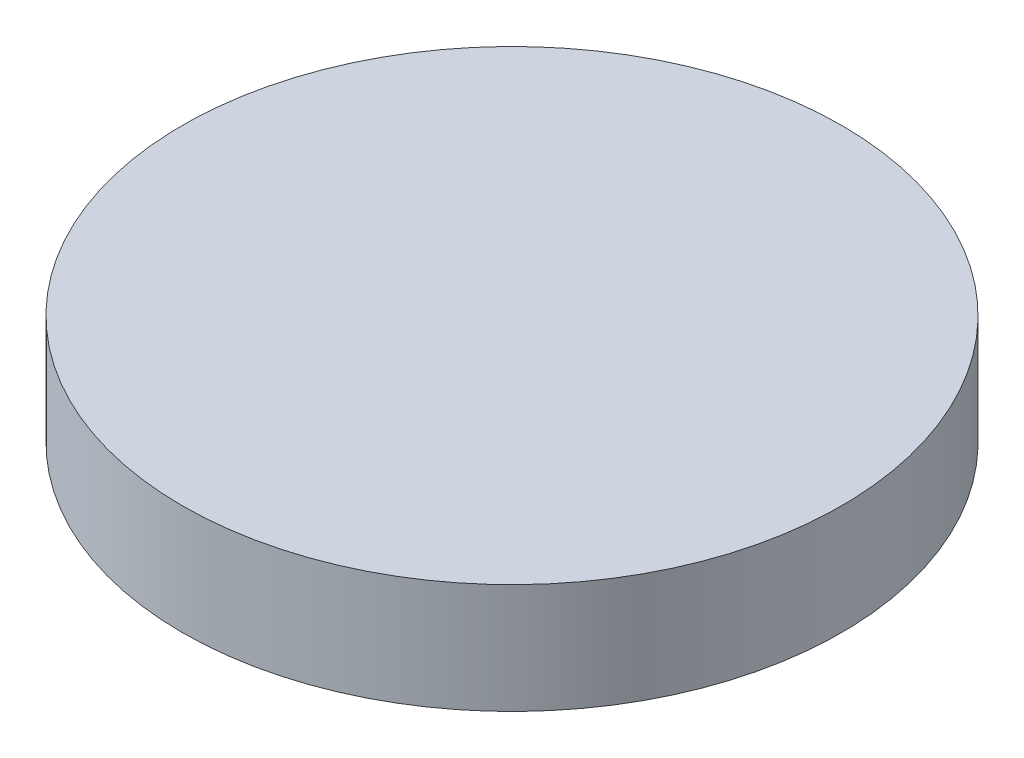
from build123d import *

# Parameters (mm, degrees)
SKETCH1_R           = 76.2
BOSS_EXTRUDE1_DEPTH = 25.4


with BuildPart() as part:
    # Sketch1 → Boss-Extrude1 (new body)
    with BuildSketch(Plane(origin=(0, 0, 0), x_dir=(1, 0, 0), z_dir=(0, 1, 0))):
        with Locations(Location((0, 0, 0), (0, 0, 270))):
            Circle(SKETCH1_R)
    extrude(amount=-BOSS_EXTRUDE1_DEPTH)


solid = part.part
